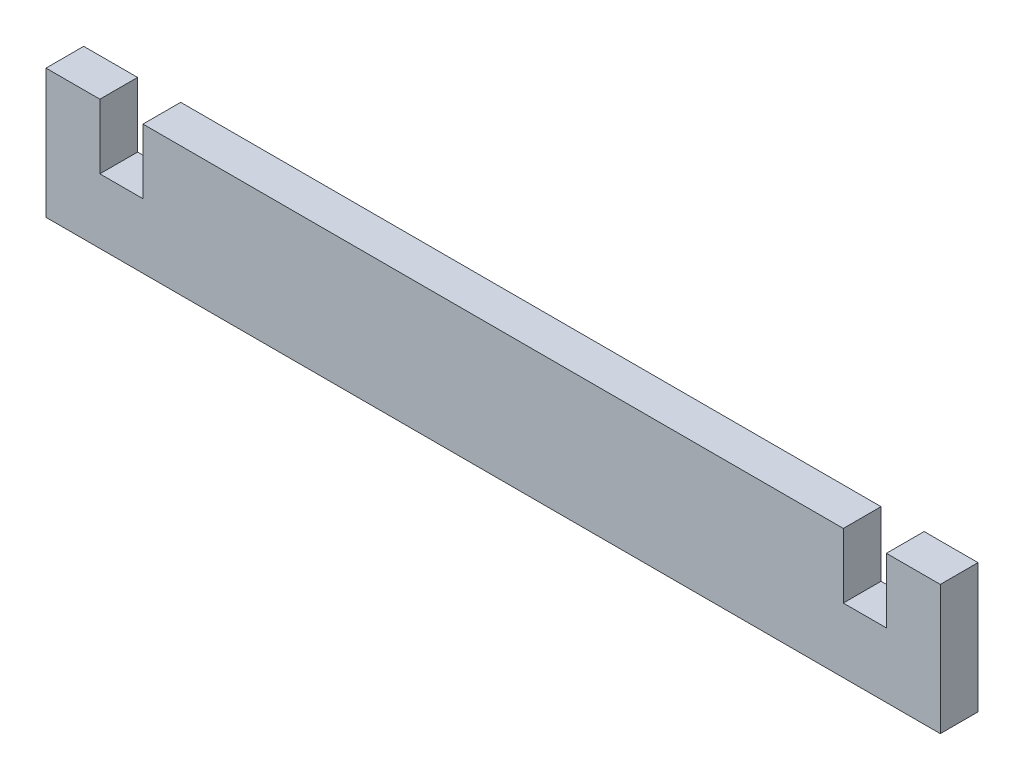
from build123d import *

# Parameters (mm, degrees)
BOSS_EXTRUDE1_DEPTH = 3.5


with BuildPart() as part:
    # Sketch1 → Boss-Extrude1 (new body)
    with BuildSketch(Plane.XY):
        Polygon((-32.5, 6), (32.5, 6), (32.5, 0), (36.5, 0), (36.5, 6), (41.5, 6), (41.5, -6), (-41.5, -6), (-41.5, 6), (-36.5, 6), (-36.5, 0), (-32.5, 0), align=None)
    extrude(amount=BOSS_EXTRUDE1_DEPTH)


solid = part.part
